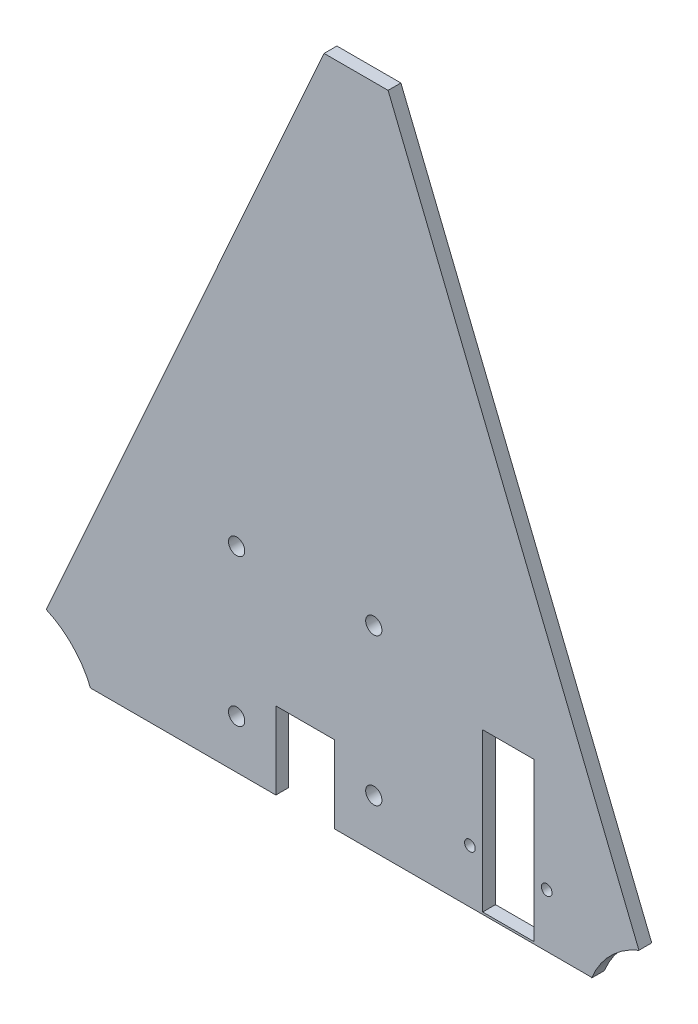
from build123d import *

# Parameters (mm, degrees)
BOSS_EXTRUDE1_DEPTH     = 7.62
SKETCH5_R               = 15.875
CUT_EXTRUDE2_DEPTH      = 50.8
SKETCH6_R               = 15.875
CUT_EXTRUDE3_DEPTH      = 50.8
CUT_EXTRUDE4_DEPTH      = 444.557362906
CUT_EXTRUDE4_DEPTH_BACK = 7.62
CUT_EXTRUDE6_REACH      = 445.557
SKETCH9_R               = 4.826
SKETCH10_W              = 30.48
SKETCH10_H              = 114.3
CUT_EXTRUDE12_DEPTH     = 25.4
CUT_EXTRUDE14_REACH     = 445.557
SKETCH14_R              = 50.8
CUT_EXTRUDE15_REACH     = 445.557
SKETCH15_R              = 50.8
SKETCH16_W              = 30.48
SKETCH16_H              = 20.32
BOSS_EXTRUDE2_DEPTH     = 7.62
CUT_EXTRUDE16_REACH     = 433.743
SKETCH17_R              = 3.175
CUT_EXTRUDE17_START     = -7.62
SKETCH18_W              = 300.609514784
SKETCH18_H              = 19.05
CUT_EXTRUDE17_DEPTH     = 7.62
CUT_EXTRUDE18_REACH     = 433.743
SKETCH19_R              = 4.826


with BuildPart() as part:
    # Sketch2 → Boss-Extrude1 (new body)
    with BuildSketch(Plane.XY):
        Polygon((-189.740054039, 245.383385713), (-375.90852523, -170.414614287), (16.77547477, -170.414614287), (-151.640054039, 245.383385713), align=None)
    extrude(amount=BOSS_EXTRUDE1_DEPTH)

    # Sketch5 → Cut-Extrude2 (cut)
    with BuildSketch(Plane(origin=(0, 0, 0), x_dir=(-1, 0, 0), z_dir=(0, 0, -1))):
        with Locations((375.90852523, -170.414614287)):
            Circle(SKETCH5_R)
    extrude(amount=-CUT_EXTRUDE2_DEPTH, mode=Mode.SUBTRACT)

    # Sketch6 → Cut-Extrude3 (cut)
    with BuildSketch(Plane(origin=(0, 0, 0), x_dir=(-1, 0, 0), z_dir=(0, 0, -1))):
        with Locations((-16.77547477, -170.414614287)):
            Circle(SKETCH6_R)
    extrude(amount=-CUT_EXTRUDE3_DEPTH, mode=Mode.SUBTRACT)

    # Sketch8 → Cut-Extrude4 (cut, two sides: drawn at the far end of the back side and taken through both)
    with BuildSketch(Plane(origin=(0, 0, 0), x_dir=(-1, 0, 0), z_dir=(0, 0, -1)).offset(-CUT_EXTRUDE4_DEPTH_BACK)):
        Polygon((218.448947474, -1130.046710402), (218.448947474, -170.414614287), (218.448947474, -105.390614287), (183.523947474, -105.390614287), (183.523947474, -170.414614287), (183.523947474, -1130.046710402), (183.523947474, -3049.310902633), (218.448947474, -3049.310902633), align=None)
    extrude(amount=CUT_EXTRUDE4_DEPTH + CUT_EXTRUDE4_DEPTH_BACK, mode=Mode.SUBTRACT)

    # Sketch9 → Cut-Extrude6 (cut, up to next)
    with BuildSketch(Plane(origin=(0, 0, 0), x_dir=(-1, 0, 0), z_dir=(0, 0, -1)), mode=Mode.PRIVATE) as cut_extrude6_sk1:
        with Locations((160.155947474, -122.408614287)):
            Circle(SKETCH9_R)
    cut_extrude6_tool1 = extrude(cut_extrude6_sk1.sketch, amount=-CUT_EXTRUDE6_REACH, mode=Mode.PRIVATE) & part.part
    # Sketch9 → Cut-Extrude6 (cut, up to next)
    with BuildSketch(Plane(origin=(0, 0, 0), x_dir=(-1, 0, 0), z_dir=(0, 0, -1)), mode=Mode.PRIVATE) as cut_extrude6_sk2:
        with Locations((241.816947474, -122.408614287)):
            Circle(SKETCH9_R)
    cut_extrude6_tool2 = extrude(cut_extrude6_sk2.sketch, amount=-CUT_EXTRUDE6_REACH, mode=Mode.PRIVATE) & part.part
    add(cut_extrude6_tool1.solids().sort_by_distance((-160.155947, -122.408614, 0))[0], mode=Mode.SUBTRACT)
    add(cut_extrude6_tool2.solids().sort_by_distance((-241.816947, -122.408614, 0))[0], mode=Mode.SUBTRACT)

    # Sketch10 → Cut-Extrude12 (cut)
    with BuildSketch(Plane(origin=(0, 0, 0), x_dir=(-1, 0, 0), z_dir=(0, 0, -1))):
        with Locations((80.066257047, -113.264614287)):
            Rectangle(SKETCH10_W, SKETCH10_H)
    extrude(amount=-CUT_EXTRUDE12_DEPTH, mode=Mode.SUBTRACT)

    # Sketch14 → Cut-Extrude14 (cut, up to next)
    with BuildSketch(Plane(origin=(0, 0, 0), x_dir=(-1, 0, 0), z_dir=(0, 0, -1)), mode=Mode.PRIVATE) as cut_extrude14_sk1:
        with Locations((-16.77547477, -170.414614287)):
            Circle(SKETCH14_R)
    cut_extrude14_tool1 = extrude(cut_extrude14_sk1.sketch, amount=-CUT_EXTRUDE14_REACH, mode=Mode.PRIVATE) & part.part
    add(cut_extrude14_tool1.solids().sort_by_distance((16.775475, -170.414614, 0))[0], mode=Mode.SUBTRACT)

    # Sketch15 → Cut-Extrude15 (cut, up to next)
    with BuildSketch(Plane(origin=(0, 0, 0), x_dir=(-1, 0, 0), z_dir=(0, 0, -1)), mode=Mode.PRIVATE) as cut_extrude15_sk1:
        with Locations((375.90852523, -170.414614287)):
            Circle(SKETCH15_R)
    cut_extrude15_tool1 = extrude(cut_extrude15_sk1.sketch, amount=-CUT_EXTRUDE15_REACH, mode=Mode.PRIVATE) & part.part
    add(cut_extrude15_tool1.solids().sort_by_distance((-375.908525, -170.414614, 0))[0], mode=Mode.SUBTRACT)

    # Sketch16 → Boss-Extrude2 (add)
    with BuildSketch(Plane(origin=(0, 0, 0), x_dir=(-1, 0, 0), z_dir=(0, 0, -1))):
        with Locations((80.066257047, -160.254614287)):
            Rectangle(SKETCH16_W, SKETCH16_H)
    extrude(amount=-BOSS_EXTRUDE2_DEPTH)

    # Sketch17 → Cut-Extrude16 (cut, up to next)
    with BuildSketch(Plane(origin=(0, 0, 0), x_dir=(-1, 0, 0), z_dir=(0, 0, -1)), mode=Mode.PRIVATE) as cut_extrude16_sk1:
        with Locations((57.206257047, -119.614614287)):
            Circle(SKETCH17_R)
    cut_extrude16_tool1 = extrude(cut_extrude16_sk1.sketch, amount=-CUT_EXTRUDE16_REACH, mode=Mode.PRIVATE) & part.part
    # Sketch17 → Cut-Extrude16 (cut, up to next)
    with BuildSketch(Plane(origin=(0, 0, 0), x_dir=(-1, 0, 0), z_dir=(0, 0, -1)), mode=Mode.PRIVATE) as cut_extrude16_sk2:
        with Locations((102.926257047, -119.614614287)):
            Circle(SKETCH17_R)
    cut_extrude16_tool2 = extrude(cut_extrude16_sk2.sketch, amount=-CUT_EXTRUDE16_REACH, mode=Mode.PRIVATE) & part.part
    add(cut_extrude16_tool1.solids().sort_by_distance((-57.206257, -119.614614, 0))[0], mode=Mode.SUBTRACT)
    add(cut_extrude16_tool2.solids().sort_by_distance((-102.926257, -119.614614, 0))[0], mode=Mode.SUBTRACT)

    # Sketch18 → Cut-Extrude17 (cut)
    with BuildSketch(Plane(origin=(0, 0, 0), x_dir=(-1, 0, 0), z_dir=(0, 0, -1)).offset(CUT_EXTRUDE17_START)):
        with Locations((180.749872138, -160.889614287)):
            Rectangle(SKETCH18_W, SKETCH18_H)
    extrude(amount=CUT_EXTRUDE17_DEPTH, mode=Mode.SUBTRACT)

    # Sketch19 → Cut-Extrude18 (cut, up to next)
    with BuildSketch(Plane(origin=(0, 0, 0), x_dir=(-1, 0, 0), z_dir=(0, 0, -1)), mode=Mode.PRIVATE) as cut_extrude18_sk1:
        with Locations((241.816947474, -34.778614287)):
            Circle(SKETCH19_R)
    cut_extrude18_tool1 = extrude(cut_extrude18_sk1.sketch, amount=-CUT_EXTRUDE18_REACH, mode=Mode.PRIVATE) & part.part
    # Sketch19 → Cut-Extrude18 (cut, up to next)
    with BuildSketch(Plane(origin=(0, 0, 0), x_dir=(-1, 0, 0), z_dir=(0, 0, -1)), mode=Mode.PRIVATE) as cut_extrude18_sk2:
        with Locations((160.155947474, -34.778614287)):
            Circle(SKETCH19_R)
    cut_extrude18_tool2 = extrude(cut_extrude18_sk2.sketch, amount=-CUT_EXTRUDE18_REACH, mode=Mode.PRIVATE) & part.part
    add(cut_extrude18_tool1.solids().sort_by_distance((-241.816947, -34.778614, 0))[0], mode=Mode.SUBTRACT)
    add(cut_extrude18_tool2.solids().sort_by_distance((-160.155947, -34.778614, 0))[0], mode=Mode.SUBTRACT)


solid = part.part
